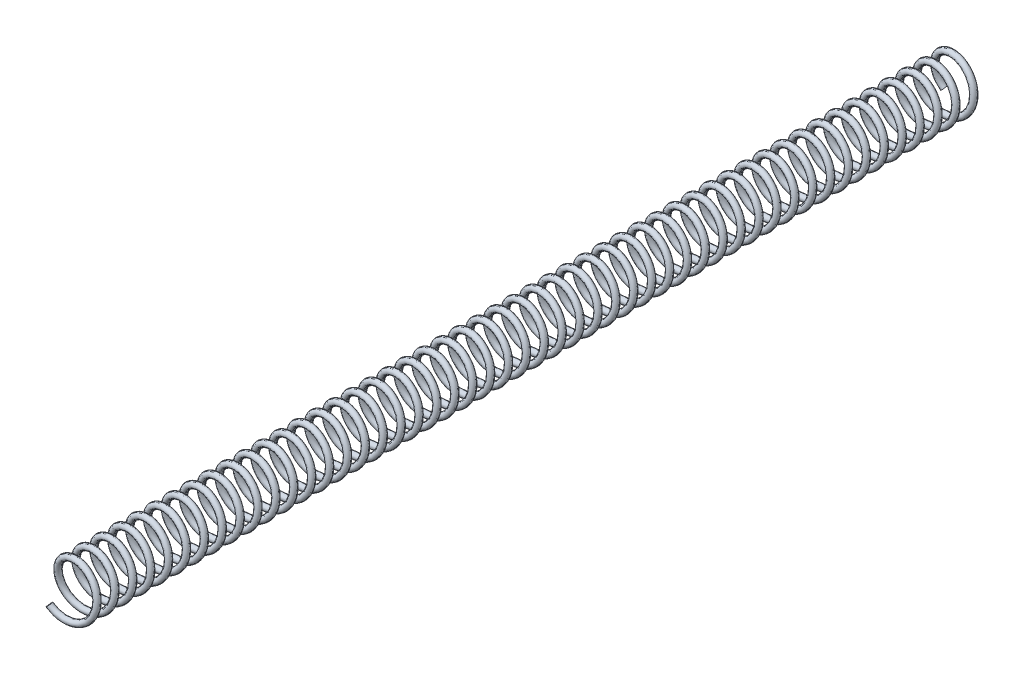
from build123d import *

# Parameters (mm, degrees)
SWEEP1_PITCH       = 3
SWEEP1_HEIGHT      = 150
SWEEP1_RADIUS      = 4
SWEEP1_START_ANGLE = -135
SWEEP1_PROFILE_R   = 0.5


with BuildPart() as part:
    # Sweep1: sweep along a helix
    with BuildLine() as sweep1_path:
        add(Helix(SWEEP1_PITCH, SWEEP1_HEIGHT, SWEEP1_RADIUS, center=(0, 0, 0), direction=(0, 0, 1), lefthand=True, mode=Mode.PRIVATE).rotate(Axis((0, 0, 0), (0, 0, 1)), SWEEP1_START_ANGLE))
    # Sweep1 profile (on start of the path) → Sweep1 (sweep)
    with BuildSketch(Plane(origin=(-2.828427125, -2.828427125, 0), x_dir=(-0.7071067811860747, -0.7071067811870204, 0), z_dir=(-0.7021224502879106, 0.7021224502869717, 0.1185248058623993))):
        Circle(SWEEP1_PROFILE_R)
    sweep(path=sweep1_path.line, is_frenet=True)


solid = part.part
